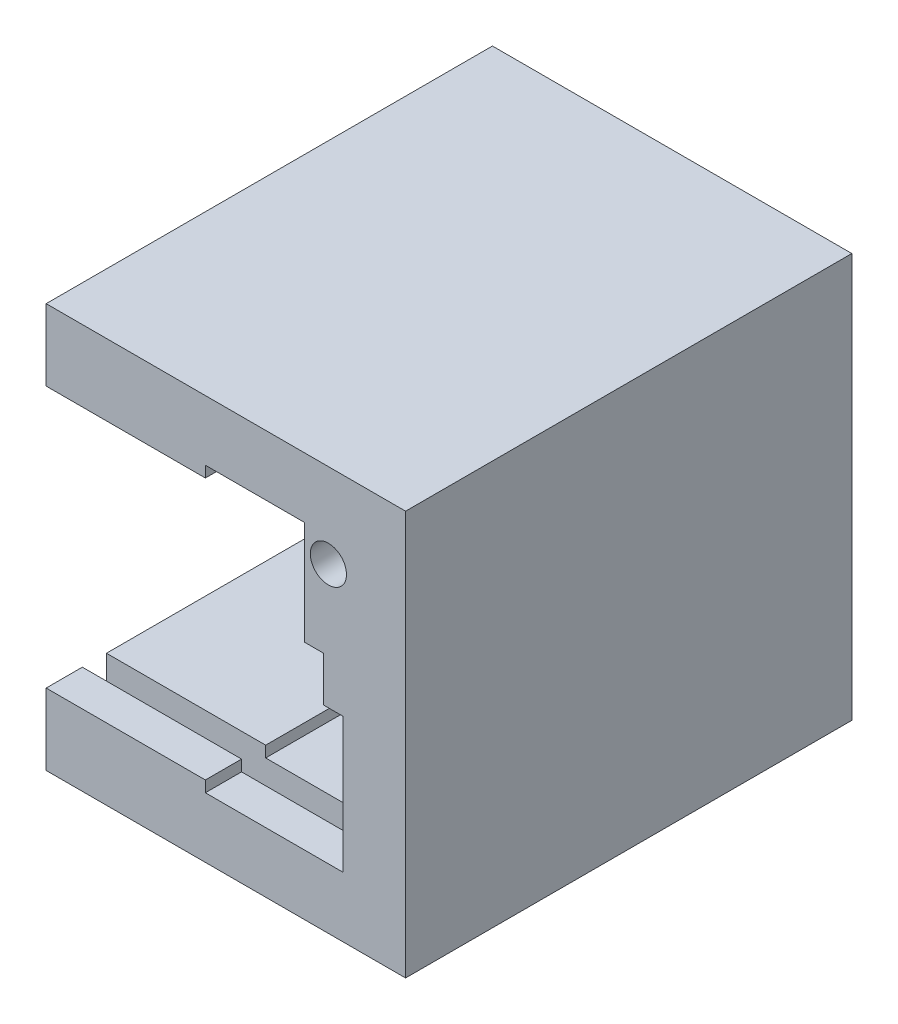
from build123d import *

# Parameters (mm, degrees)
SKETCH1_W           = 18.923
SKETCH1_H           = 21.2852
BOSS_EXTRUDE1_DEPTH = 23.495
CUT_EXTRUDE1_DEPTH  = 18.1102
SKETCH3_W           = 6.223
SKETCH3_H           = 4.0132
CUT_EXTRUDE2_DEPTH  = 3.4798
SKETCH4_W           = 2.9718
SKETCH4_H           = 5.6642
CUT_EXTRUDE3_DEPTH  = 1.4478
SKETCH5_W           = 1.27
SKETCH5_H           = 17.4752
CUT_EXTRUDE4_DEPTH  = 16.51
SKETCH7_R           = 0.9525
CUT_EXTRUDE6_DEPTH  = 5.08


with BuildPart() as part:
    # Sketch1 → Boss-Extrude1 (new body)
    with BuildSketch(Plane.XY):
        Rectangle(SKETCH1_W, SKETCH1_H)
    extrude(amount=BOSS_EXTRUDE1_DEPTH)

    # Sketch2 → Cut-Extrude1 (cut)
    with BuildSketch(Plane.XY.offset(23.495)):
        Polygon((-9.4615, 6.8834), (-9.4615, -6.8834), (-1.0795, -6.8834), (-1.0795, -7.4676), (6.1595, -7.4676), (6.1595, -0.3556), (5.1435, -0.3556), (5.1435, 2.0066), (4.1275, 2.0066), (4.1275, 7.4676), (-1.0795, 7.4676), (-1.0795, 6.8834), align=None)
    extrude(amount=-CUT_EXTRUDE1_DEPTH, mode=Mode.SUBTRACT)

    # Sketch3 → Cut-Extrude2 (cut)
    with BuildSketch(Plane.XY.offset(5.3848)):
        with Locations((2.032, 0)):
            Rectangle(SKETCH3_W, SKETCH3_H)
    extrude(amount=-CUT_EXTRUDE2_DEPTH, mode=Mode.SUBTRACT)

    # Sketch4 → Cut-Extrude3 (cut)
    with BuildSketch(Plane.XY.offset(5.3848)):
        with Locations((4.6736, -4.6355)):
            Rectangle(SKETCH4_W, SKETCH4_H)
    extrude(amount=-CUT_EXTRUDE3_DEPTH, mode=Mode.SUBTRACT)

    # Sketch5 → Cut-Extrude4 (cut)
    with BuildSketch(Plane.ZY.offset(9.4615)):
        with Locations((20.955, 0)):
            Rectangle(SKETCH5_W, SKETCH5_H)
    extrude(amount=-CUT_EXTRUDE4_DEPTH, mode=Mode.SUBTRACT)

    # Sketch7 → Cut-Extrude6 (cut)
    with BuildSketch(Plane.XY.offset(23.495)):
        with Locations((5.3975, 6.1976)):
            Circle(SKETCH7_R)
    extrude(amount=-CUT_EXTRUDE6_DEPTH, mode=Mode.SUBTRACT)


solid = part.part
